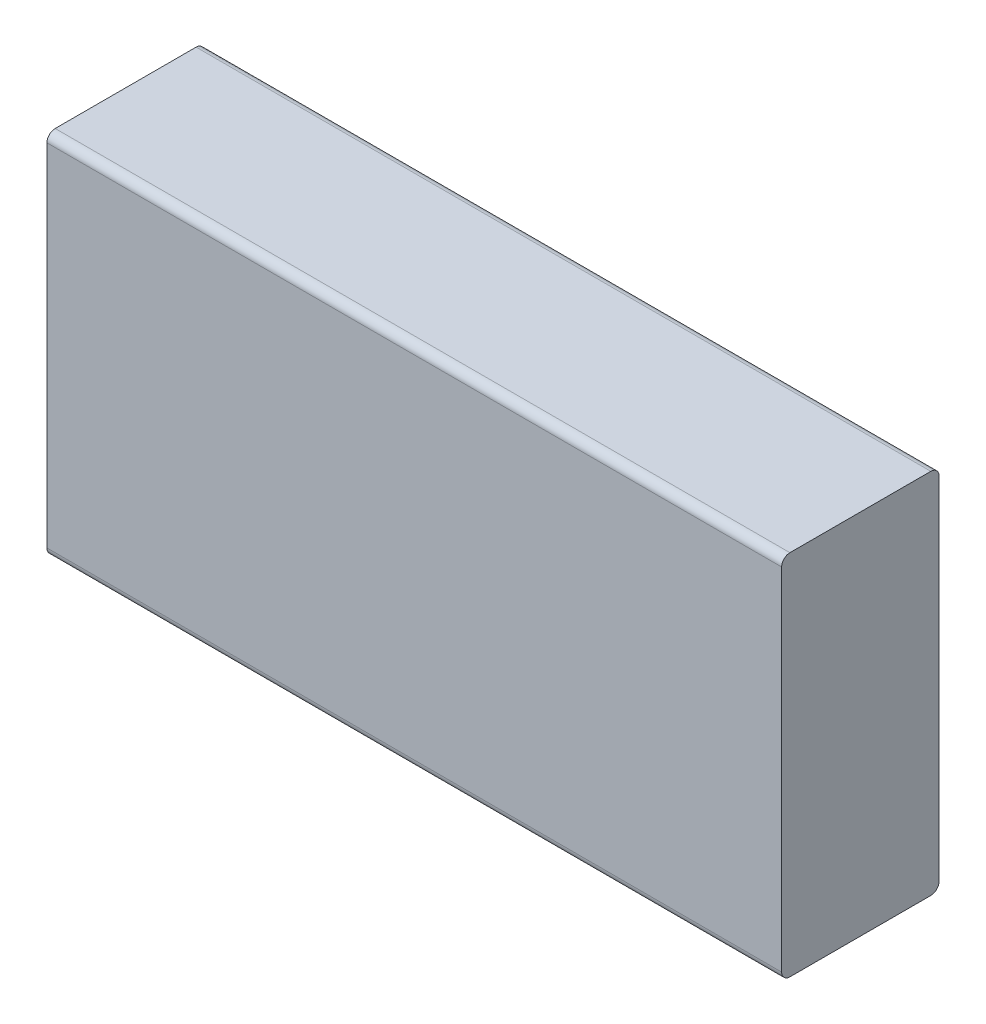
from build123d import *

# Parameters (mm, degrees)
SKETCH1_W           = 88.9
SKETCH1_H           = 38.1
BOSS_EXTRUDE1_DEPTH = 177.8
FILLET1_R           = 2


with BuildPart() as part:
    # Sketch1 → Boss-Extrude1 (new body)
    with BuildSketch(Plane(origin=(0, 0, 0), x_dir=(0, -1, 0), z_dir=(1, 0, 0))):
        Rectangle(SKETCH1_W, SKETCH1_H)
    extrude(amount=BOSS_EXTRUDE1_DEPTH)

    # Fillet1
    fillet1_edges = [part.edges().sort_by_distance(p)[0] for p in [
        (88.9, -44.45, 19.05),
        (88.9, 44.45, 19.05),
        (88.9, 44.45, -19.05),
        (88.9, -44.45, -19.05),
    ]]
    fillet(fillet1_edges, radius=FILLET1_R)


solid = part.part
